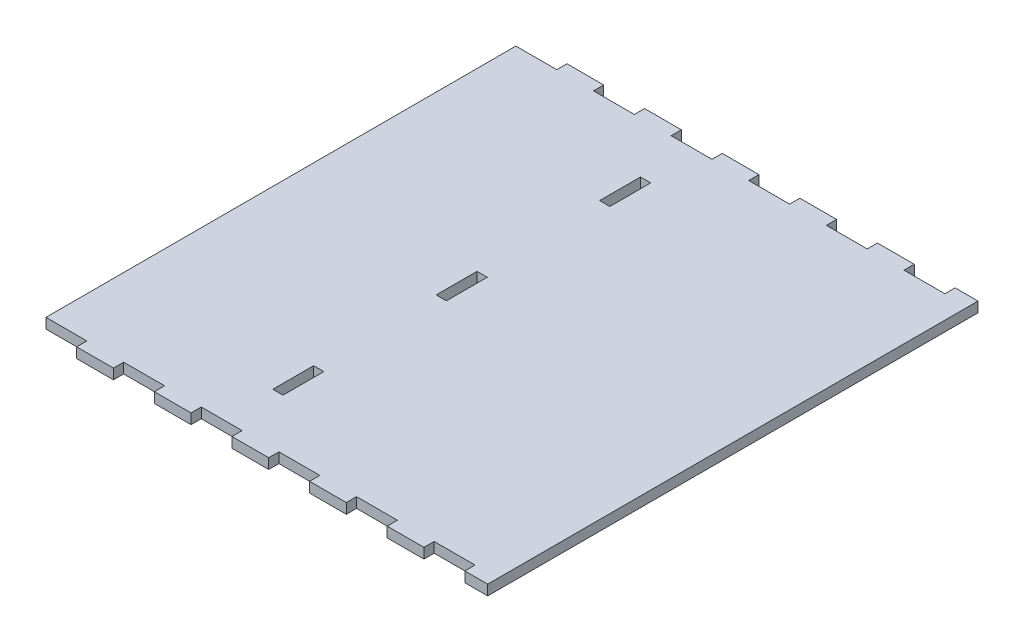
from build123d import *

# Parameters (mm, degrees)
BOSS_EXTRUDE1_DEPTH = 6.35
SKETCH2_W           = 6.35
SKETCH2_H           = 25.4
CUT_EXTRUDE1_DEPTH  = 338.387086593


with BuildPart() as part:
    # Sketch1 → Boss-Extrude1 (new body)
    with BuildSketch(Plane(origin=(0, 0, 0), x_dir=(1, 0, 0), z_dir=(0, 1, 0))):
        Polygon((-42.798869448, -43.002859963), (-19.938869448, -43.002859963), (-19.938869448, -36.652859963), (5.461130552, -36.652859963), (5.461130552, -43.002859963), (28.321130552, -43.002859963), (28.321130552, -36.652859963), (53.721130552, -36.652859963), (53.721130552, -43.002859963), (76.581130552, -43.002859963), (76.581130552, -36.652859963), (101.981130552, -36.652859963), (101.981130552, -43.002859963), (124.841130552, -43.002859963), (124.841130552, -36.652859963), (150.241130552, -36.652859963), (150.241130552, -43.002859963), (173.101130552, -43.002859963), (173.101130552, -36.652859963), (198.501130552, -36.652859963), (198.501130552, -43.002859963), (212.725130552, -43.002859963), (212.725130552, 261.797140037), (198.501130552, 261.797140037), (198.501130552, 255.447140037), (173.101130552, 255.447140037), (173.101130552, 261.797140037), (150.241130552, 261.797140037), (150.241130552, 255.447140037), (124.841130552, 255.447140037), (124.841130552, 261.797140037), (101.981130552, 261.797140037), (101.981130552, 255.447140037), (76.581130552, 255.447140037), (76.581130552, 261.797140037), (53.721130552, 261.797140037), (53.721130552, 255.447140037), (28.321130552, 255.447140037), (28.321130552, 261.797140037), (5.461130552, 261.797140037), (5.461130552, 255.447140037), (-19.938869448, 255.447140037), (-19.938869448, 261.797140037), (-42.798869448, 261.797140037), (-42.798869448, 255.447140037), (-68.198869448, 255.447140037), (-68.198869448, -36.652859963), (-42.798869448, -36.652859963), align=None)
    extrude(amount=BOSS_EXTRUDE1_DEPTH)

    # Sketch2 → Cut-Extrude1 (cut, through all)
    with BuildSketch(Plane(origin=(0, 6.35, 0), x_dir=(1, 0, 0), z_dir=(0, 1, 0))):
        with Locations((44.196130552, 210.997140037)):
            Rectangle(SKETCH2_W, SKETCH2_H)
        with Locations((44.196130552, 7.797140037)):
            Rectangle(SKETCH2_W, SKETCH2_H)
        with Locations((44.196130552, 109.397140037)):
            Rectangle(SKETCH2_W, SKETCH2_H)
    extrude(amount=-CUT_EXTRUDE1_DEPTH, mode=Mode.SUBTRACT)


solid = part.part
